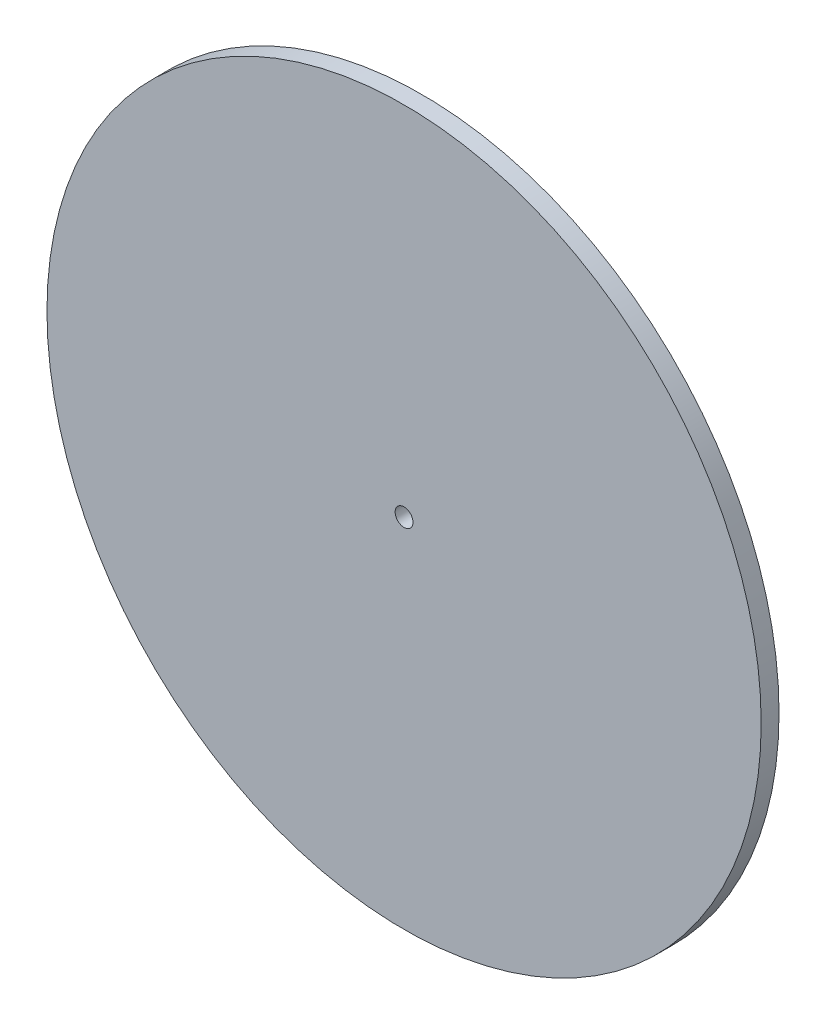
from build123d import *

# Parameters (mm, degrees)
SKETCH1_R           = 100
SKETCH1_R_2         = 2.5
BOSS_EXTRUDE1_DEPTH = 5


with BuildPart() as part:
    # Sketch1 → Boss-Extrude1 (new body)
    with BuildSketch(Plane.XY):
        Circle(SKETCH1_R)
        Circle(SKETCH1_R_2, mode=Mode.SUBTRACT)
    extrude(amount=-BOSS_EXTRUDE1_DEPTH)


solid = part.part
